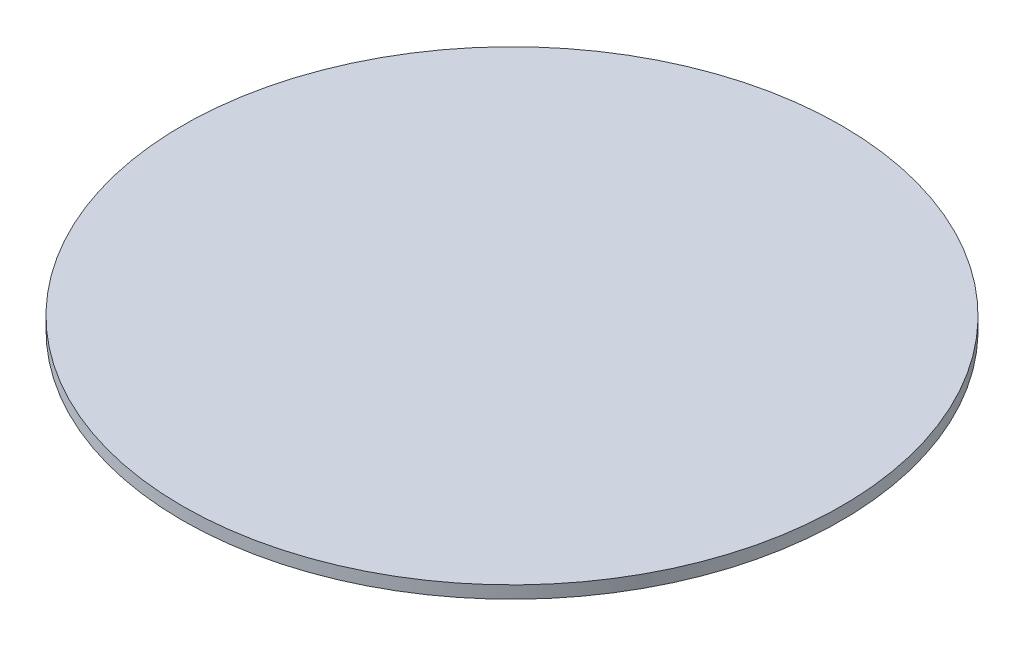
from build123d import *

# Parameters (mm, degrees)
SKETCH1_R           = 158.75
BOSS_EXTRUDE1_DEPTH = 6


with BuildPart() as part:
    # Sketch1 → Boss-Extrude1 (new body)
    with BuildSketch(Plane(origin=(0, 0, 0), x_dir=(1, 0, 0), z_dir=(0, 1, 0))):
        with Locations(Location((0, 0, 0), (0, 0, 270))):
            Circle(SKETCH1_R)
    extrude(amount=BOSS_EXTRUDE1_DEPTH)


solid = part.part
